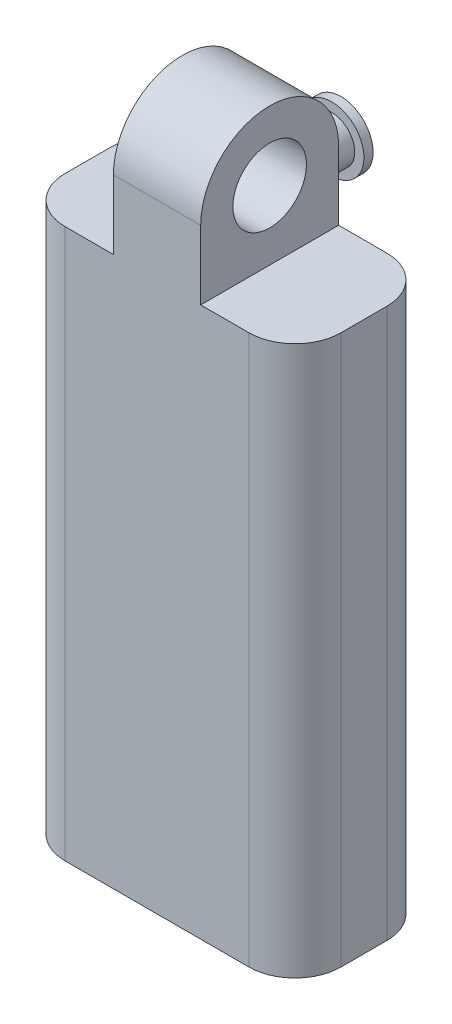
from build123d import *

# Parameters (mm, degrees)
BOSS_EXTRUDE1_DEPTH     = 29.87
SKETCH2_W               = 4.75
SKETCH2_H               = 7.5
BOSS_EXTRUDE2_DEPTH     = 7.5
CUT_EXTRUDE1_DEPTH      = 39.834199168
CUT_EXTRUDE1_DEPTH_BACK = 39.834199168
SKETCH3_R               = 2
SKETCH4_R               = 1.25
BOSS_EXTRUDE3_DEPTH     = 2
SKETCH5_R               = 1.75
BOSS_EXTRUDE4_DEPTH     = 0.5


with BuildPart() as part:
    # Sketch1 → Boss-Extrude1 (new body)
    with BuildSketch(Plane(origin=(0, 0, 0), x_dir=(1, 0, 0), z_dir=(0, 1, 0))):
        with BuildLine():
            Line((-5, 3.75), (5, 3.75))
            ThreePointArc((5, 3.75), (6.767766953, 3.017766953), (7.5, 1.25))
            Line((7.5, 1.25), (7.5, -1.25))
            ThreePointArc((7.5, -1.25), (6.767766953, -3.017766953), (5, -3.75))
            Line((5, -3.75), (-5, -3.75))
            ThreePointArc((-5, -3.75), (-6.767766953, -3.017766953), (-7.5, -1.25))
            Line((-7.5, -1.25), (-7.5, 1.25))
            ThreePointArc((-7.5, 1.25), (-6.767766953, 3.017766953), (-5, 3.75))
        make_face()
    extrude(amount=BOSS_EXTRUDE1_DEPTH)

    # Sketch2 → Boss-Extrude2 (add)
    with BuildSketch(Plane(origin=(0, 29.87, 0), x_dir=(1, 0, 0), z_dir=(0, 1, 0))):
        Rectangle(SKETCH2_W, SKETCH2_H)
    extrude(amount=BOSS_EXTRUDE2_DEPTH)

    # Sketch3 → Cut-Extrude1 (cut, two sides: drawn at the far end of the back side and taken through both)
    with BuildSketch(Plane.ZY.offset(2.375).offset(-CUT_EXTRUDE1_DEPTH_BACK)):
        with BuildLine():
            Line((-3.75, 37.37), (-3.75, 33.62))
            ThreePointArc((-3.75, 33.62), (-2.651650429, 36.271650429), (0, 37.37))
            Line((0, 37.37), (-3.75, 37.37))
        make_face()
        with BuildLine():
            ThreePointArc((0, 37.37), (2.651650429, 36.271650429), (3.75, 33.62))
            Line((3.75, 33.62), (3.75, 37.37))
            Line((3.75, 37.37), (0, 37.37))
        make_face()
        with Locations((0, 33.62)):
            Circle(SKETCH3_R)
    extrude(amount=CUT_EXTRUDE1_DEPTH + CUT_EXTRUDE1_DEPTH_BACK, mode=Mode.SUBTRACT)

    # Sketch4 → Boss-Extrude3 (add)
    with BuildSketch(Plane(origin=(0, 0, -3.75), x_dir=(-1, 0, 0), z_dir=(0, 0, -1))):
        with Locations(Location((0, 31.745, 0), (0, 0, 180))):
            Circle(SKETCH4_R)
    extrude(amount=BOSS_EXTRUDE3_DEPTH)

    # Sketch5 → Boss-Extrude4 (add)
    with BuildSketch(Plane(origin=(0, 0, -5.75), x_dir=(-1, 0, 0), z_dir=(0, 0, -1))):
        with Locations((0, 31.745)):
            Circle(SKETCH5_R)
    extrude(amount=BOSS_EXTRUDE4_DEPTH)


solid = part.part
